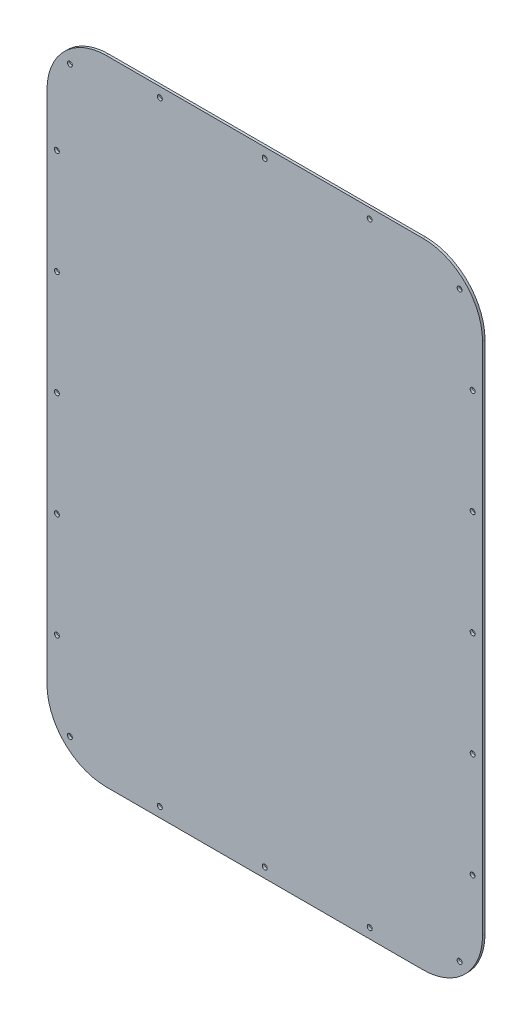
from build123d import *

# Parameters (mm, degrees)
MODEL_R             = 3.175
BOSS_EXTRUDE1_DEPTH = 3.175


with BuildPart() as part:
    # Model → Boss-Extrude1 (new body)
    with BuildSketch(Plane.XY):
        with BuildLine():
            Line((76.2, 1549.53973), (76.2, 889.13973))
            ThreePointArc((76.2, 889.13973), (98.518463274, 835.258193274), (152.4, 812.93973))
            Line((152.4, 812.93973), (558.8, 812.93973))
            ThreePointArc((558.8, 812.93973), (612.681536726, 835.258193274), (635, 889.13973))
            Line((635, 889.13973), (635, 1549.53973))
            ThreePointArc((635, 1549.53973), (612.681536726, 1603.421266726), (558.8, 1625.73973))
            Line((558.8, 1625.73973), (152.4, 1625.73973))
            ThreePointArc((152.4, 1625.73973), (98.518463274, 1603.421266726), (76.2, 1549.53973))
        make_face()
        with Locations((605.617315646, 1592.867273144)):
            Circle(MODEL_R, mode=Mode.SUBTRACT)
        with Locations((605.617315646, 845.812186856)):
            Circle(MODEL_R, mode=Mode.SUBTRACT)
        with Locations((105.582684354, 845.812186856)):
            Circle(MODEL_R, mode=Mode.SUBTRACT)
        with Locations((88.9, 1219.33973)):
            Circle(MODEL_R, mode=Mode.SUBTRACT)
        with Locations((88.9, 1084.71973)):
            Circle(MODEL_R, mode=Mode.SUBTRACT)
        with Locations((88.9, 1488.57973)):
            Circle(MODEL_R, mode=Mode.SUBTRACT)
        with Locations((88.9, 1353.95973)):
            Circle(MODEL_R, mode=Mode.SUBTRACT)
        with Locations((88.9, 950.09973)):
            Circle(MODEL_R, mode=Mode.SUBTRACT)
        with Locations((622.3, 1219.33973)):
            Circle(MODEL_R, mode=Mode.SUBTRACT)
        with Locations((622.3, 950.09973)):
            Circle(MODEL_R, mode=Mode.SUBTRACT)
        with Locations((622.3, 1084.71973)):
            Circle(MODEL_R, mode=Mode.SUBTRACT)
        with Locations((622.3, 1488.57973)):
            Circle(MODEL_R, mode=Mode.SUBTRACT)
        with Locations((622.3, 1353.95973)):
            Circle(MODEL_R, mode=Mode.SUBTRACT)
        with Locations((355.6, 1613.03973)):
            Circle(MODEL_R, mode=Mode.SUBTRACT)
        with Locations((220.98, 825.63973)):
            Circle(MODEL_R, mode=Mode.SUBTRACT)
        with Locations((490.22, 825.63973)):
            Circle(MODEL_R, mode=Mode.SUBTRACT)
        with Locations((355.6, 825.63973)):
            Circle(MODEL_R, mode=Mode.SUBTRACT)
        with Locations((105.582684354, 1592.867273144)):
            Circle(MODEL_R, mode=Mode.SUBTRACT)
        with Locations((220.98, 1613.03973)):
            Circle(MODEL_R, mode=Mode.SUBTRACT)
        with Locations((490.22, 1613.03973)):
            Circle(MODEL_R, mode=Mode.SUBTRACT)
    extrude(amount=BOSS_EXTRUDE1_DEPTH)


solid = part.part
